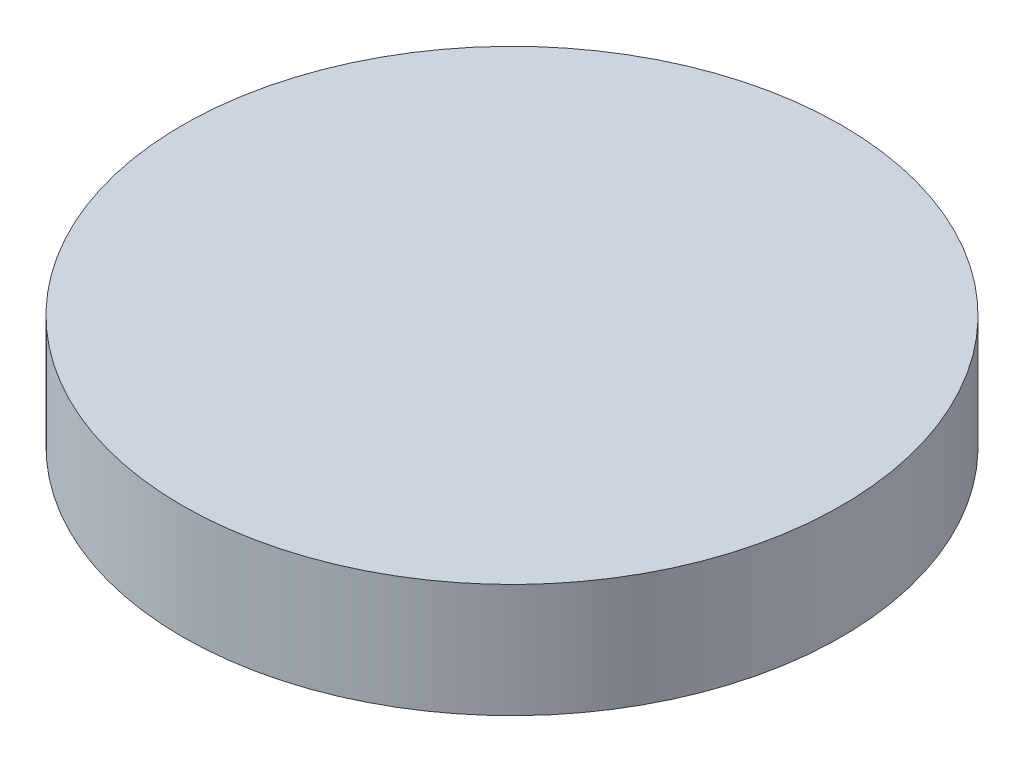
from build123d import *

# Parameters (mm, degrees)
SKETCH1_R           = 36.83
BOSS_EXTRUDE1_DEPTH = 12.7


with BuildPart() as part:
    # Sketch1 → Boss-Extrude1 (new body)
    with BuildSketch(Plane(origin=(0, 0, 0), x_dir=(1, 0, 0), z_dir=(0, 1, 0))):
        with Locations(Location((0, 0, 0), (0, 0, 270))):
            Circle(SKETCH1_R)
    extrude(amount=BOSS_EXTRUDE1_DEPTH)


solid = part.part
